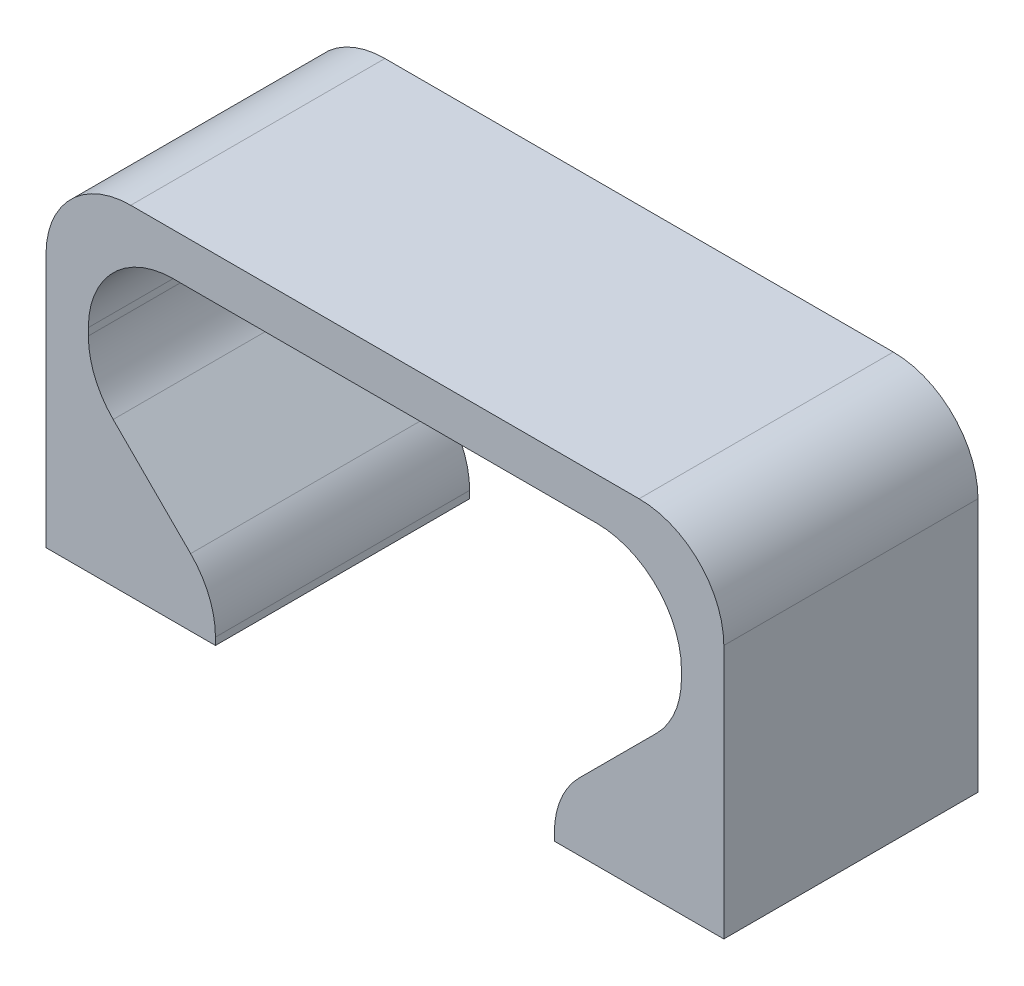
from build123d import *

# Parameters (mm, degrees)
BOSS_EXTRUDE1_DEPTH      = 7.5
BOSS_EXTRUDE1_DEPTH_BACK = 7.5
FILLET1_R                = 5


with BuildPart() as part:
    # Sketch1 → Boss-Extrude1 (new, two sides: drawn at the far end of the back side and taken through both)
    with BuildSketch(Plane.XY.offset(-BOSS_EXTRUDE1_DEPTH_BACK)):
        Polygon((-20, 20), (20, 20), (20, 0), (10, 0), (10, 2.5), (17.5, 10), (17.5, 17.5), (-17.5, 17.5), (-17.5, 10), (-10, 2.5), (-10, 0), (-20, 0), align=None)
    extrude(amount=BOSS_EXTRUDE1_DEPTH + BOSS_EXTRUDE1_DEPTH_BACK)

    # Fillet1
    fillet1_edges = [part.edges().sort_by_distance(p)[0] for p in [
        (20, 20, 0),
        (-20, 20, 0),
        (17.5, 17.5, 0),
        (-17.5, 17.5, 0),
        (17.5, 10, 0),
        (10, 2.5, 0),
        (-10, 2.5, 0),
        (-17.5, 10, 0),
    ]]
    fillet(fillet1_edges, radius=FILLET1_R)


solid = part.part
